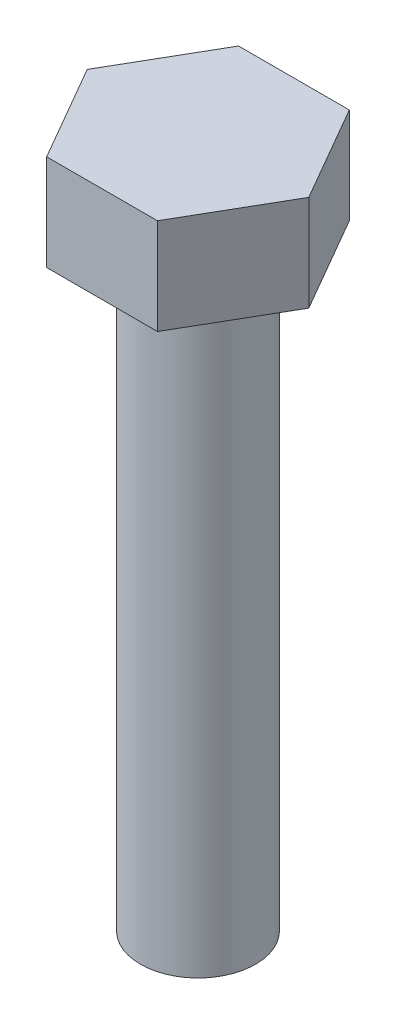
from build123d import *

# Parameters (mm, degrees)
SKETCH1_R           = 6
BOSS_EXTRUDE1_DEPTH = 62
BOSS_EXTRUDE2_DEPTH = 10


with BuildPart() as part:
    # Sketch1 → Boss-Extrude1 (new body)
    with BuildSketch(Plane(origin=(0, 0, 0), x_dir=(1, 0, 0), z_dir=(0, 1, 0))):
        with Locations(Location((0, 0, 0), (0, 0, 270))):
            Circle(SKETCH1_R)
    extrude(amount=BOSS_EXTRUDE1_DEPTH)

    # Sketch2 → Boss-Extrude2 (add)
    with BuildSketch(Plane(origin=(0, 62, 0), x_dir=(1, 0, 0), z_dir=(0, 1, 0))):
        Polygon((11.547005384, 0), (5.773502692, 10), (-5.773502692, 10), (-11.547005384, 0), (-5.773502692, -10), (5.773502692, -10), align=None)
    extrude(amount=BOSS_EXTRUDE2_DEPTH)


solid = part.part
